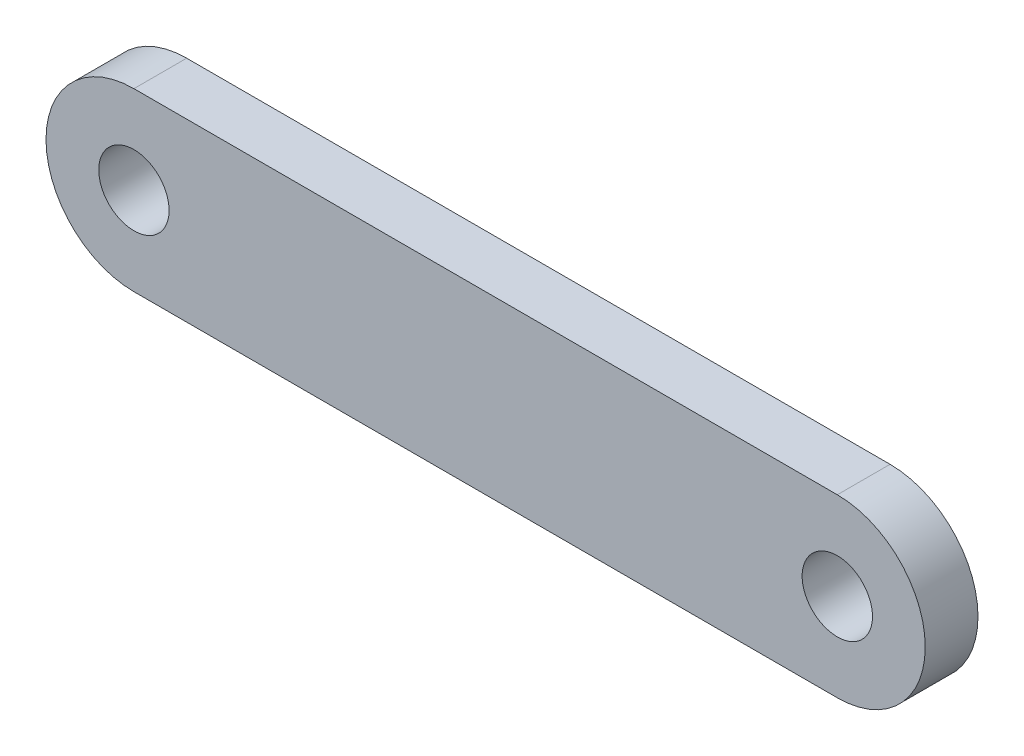
from build123d import *

# Parameters (mm, degrees)
ESQUISSE1_R        = 2
BOSS_EXTRU_1_DEPTH = 3


with BuildPart() as part:
    # Esquisse1 → Boss.-Extru.1 (new body)
    with BuildSketch(Plane.XY):
        with BuildLine():
            Line((0, 0), (40, 0))
            ThreePointArc((40, 0), (45, 5), (40, 10))
            Line((40, 10), (0, 10))
            ThreePointArc((0, 10), (-5, 5), (0, 0))
        make_face()
        with Locations((0, 5)):
            Circle(ESQUISSE1_R, mode=Mode.SUBTRACT)
        with Locations((40, 5)):
            Circle(ESQUISSE1_R, mode=Mode.SUBTRACT)
    extrude(amount=BOSS_EXTRU_1_DEPTH)


solid = part.part
